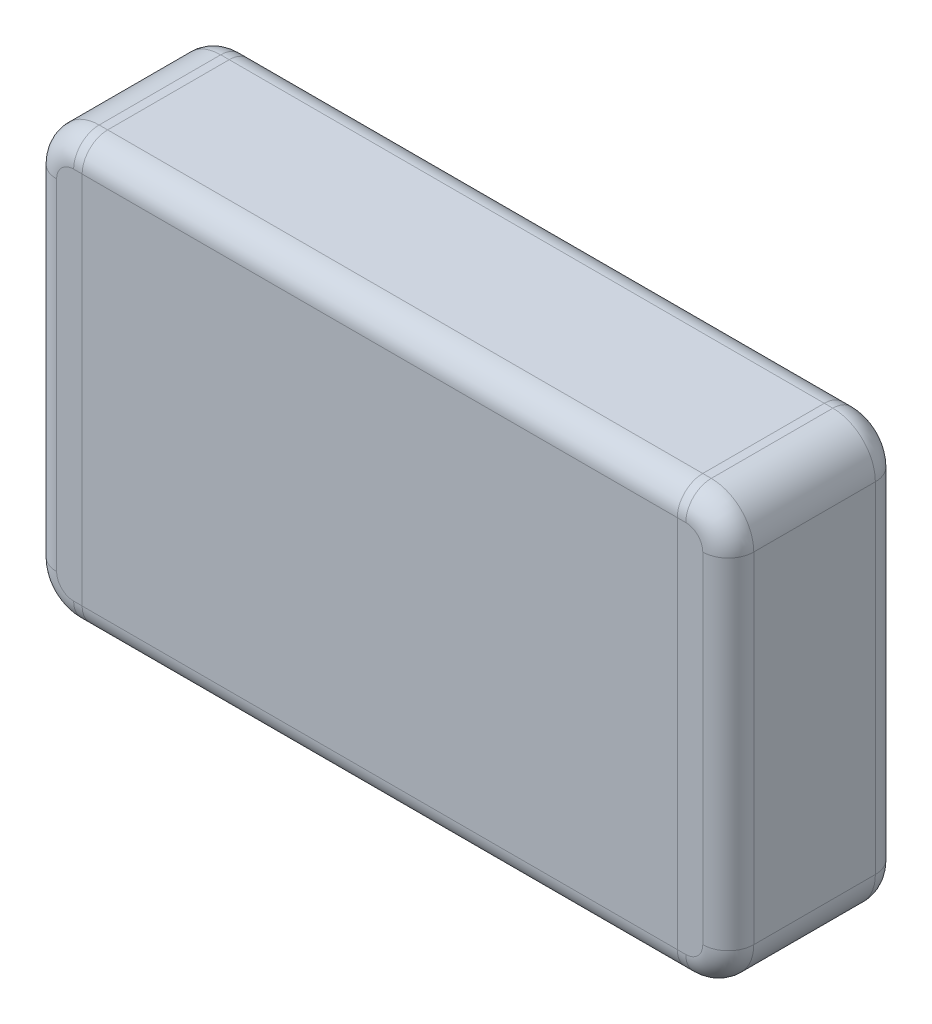
from build123d import *

# Parameters (mm, degrees)
SKETCH_1_W      = 7
SKETCH_1_H      = 5
EXTRUDE_1_DEPTH = 2.03
EXTRUDE_2_DEPTH = 2.03
FILLET_2_R      = 0.3
FILLET_1_R      = 0.3


with BuildPart() as part:
    # Эскиз1 → Бобышка-Вытянуть1 (new body)
    with BuildSketch(Plane.XY):
        Rectangle(SKETCH_1_W, SKETCH_1_H)
    extrude(amount=EXTRUDE_1_DEPTH)

    # Скругление2
    fillet_2_edges = [part.edges().sort_by_distance(p)[0] for p in [
        (0, -2.5, 2.03),
        (0, -2.5, 0),
        (0, 2.5, 0),
        (0, 2.5, 2.03),
    ]]
    fillet(fillet_2_edges, radius=FILLET_2_R)


with BuildPart() as body_2:
    # Эскиз2 → Бобышка-Вытянуть2 (new body)
    with BuildSketch(Plane(origin=(0, 0, 0), x_dir=(-1, 0, 0), z_dir=(0, 0, -1))):
        with BuildLine():
            Line((3.5, -2.5), (3.6, -2.5))
            ThreePointArc((3.6, -2.5), (3.953553391, -2.353553391), (4.1, -2))
            Line((4.1, -2), (4.1, 2))
            ThreePointArc((4.1, 2), (3.953553391, 2.353553391), (3.6, 2.5))
            Line((3.6, 2.5), (3.5, 2.5))
            Line((3.5, 2.5), (3.5, -2.5))
        make_face()
    extrude(amount=-EXTRUDE_2_DEPTH)

    # Скругление1
    fillet_1_edges = [body_2.edges().sort_by_distance(p)[0] for p in [
        (-3.953553391, -2.353553391, 2.03),
        (-4.1, 0, 2.03),
        (-3.953553391, 2.353553391, 2.03),
        (-3.55, 2.5, 2.03),
        (-3.55, 2.5, 0),
        (-3.953553391, 2.353553391, 0),
        (-4.1, 0, 0),
        (-3.55, -2.5, 2.03),
        (-3.953553391, -2.353553391, 0),
        (-3.55, -2.5, 0),
    ]]
    fillet(fillet_1_edges, radius=FILLET_1_R)


with BuildPart() as body_3:
    # Зеркальное отражение3: mirrored copy
    add(body_2.part.mirror(Plane(origin=(0, 0, 0), x_dir=(0, 0, 1), z_dir=(1, 0, 0))))


solid = Compound([part.part, body_2.part, body_3.part])
